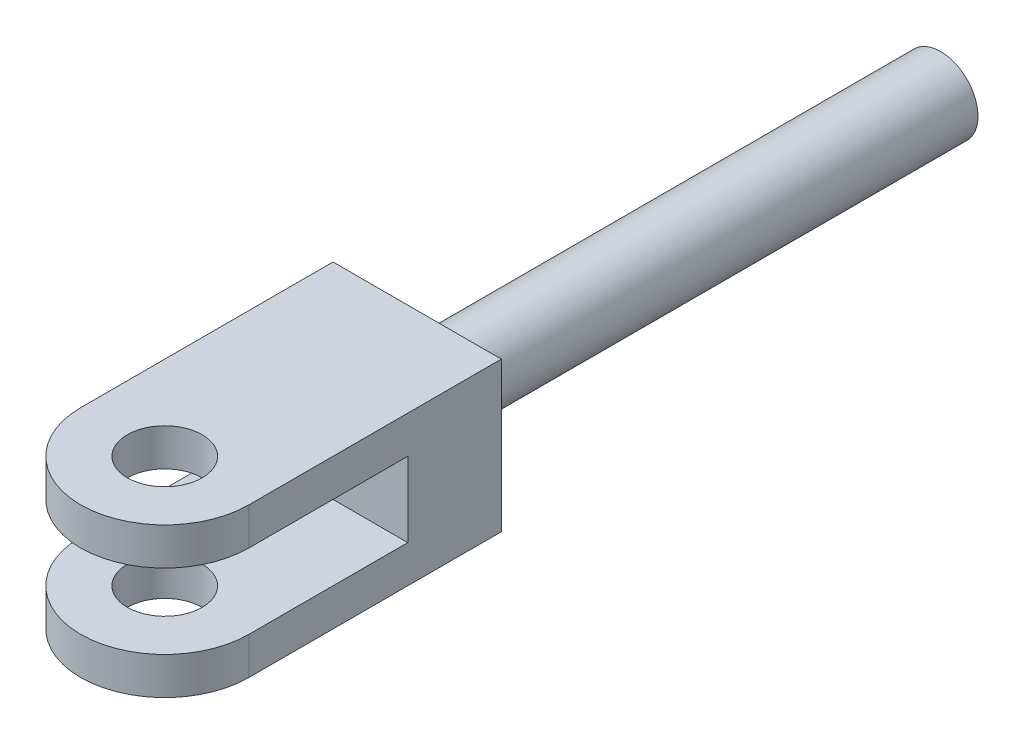
from build123d import *

# Parameters (mm, degrees)
SKETCH1_R          = 12.7
EXTRUDE1_DEPTH     = 177.8
EXTRUDE2_DEPTH     = 28.575
SKETCH3_R          = 12.7
CUT_EXTRUDE1_DEPTH = 298.858323075


with BuildPart() as part:
    # Sketch1 → Extrude1 (new body)
    with BuildSketch(Plane.XY):
        Circle(SKETCH1_R)
    extrude(amount=EXTRUDE1_DEPTH)

    # Sketch2 → Extrude2 (add, symmetric)
    with BuildSketch(Plane(origin=(0, 0, 0), x_dir=(0, 0, -1), z_dir=(1, 0, 0))):
        Polygon((-177.8, -25.4), (-177.8, 25.4), (-292.1, 25.4), (-292.1, 12.7), (-209.55, 12.7), (-209.55, -12.7), (-292.1, -12.7), (-292.1, -25.4), align=None)
    extrude(amount=EXTRUDE2_DEPTH, both=True)

    # Sketch3 → Cut-Extrude1 (cut, through all)
    with BuildSketch(Plane(origin=(0, 25.4, 0), x_dir=(-1, 0, 0), z_dir=(0, 1, 0))):
        with Locations(Location((0, 263.525, 0), (0, 0, 90))):
            Circle(SKETCH3_R)
        with BuildLine():
            Line((28.575, 263.525), (28.575, 314.325))
            Line((28.575, 314.325), (-28.575, 314.325))
            Line((-28.575, 314.325), (-28.575, 263.525))
            ThreePointArc((-28.575, 263.525), (0, 292.1), (28.575, 263.525))
        make_face()
    extrude(amount=-CUT_EXTRUDE1_DEPTH, mode=Mode.SUBTRACT)


solid = part.part
